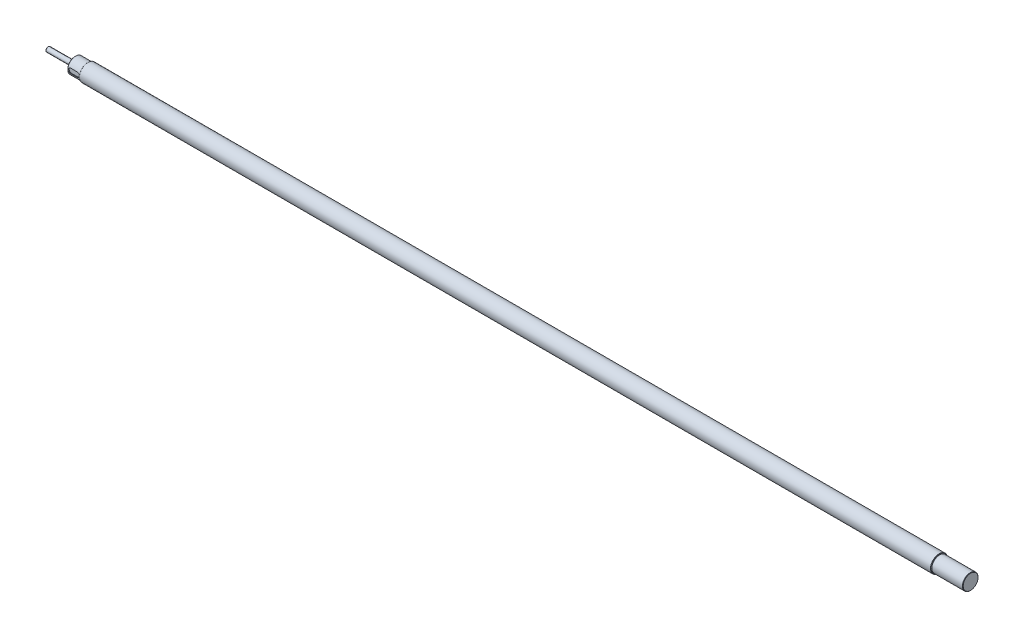
from build123d import *

# Parameters (mm, degrees)
CUT_EXTRUDE_1_DEPTH = 1.2
SKETCH_5_R          = 4
CUT_EXTRUDE_2_DEPTH = 5


with BuildPart() as part:
    # Эскиз1 → Повернуть1 (revolve)
    with BuildSketch(Plane.XY):
        with BuildLine():
            Line((0, 2.5), (0, 0))
            Line((0, 0), (720.314175827, 0))
            Line((720.314175827, 0), (1185, 0))
            Line((1185, 0), (1185, 9.5))
            Line((1185, 9.5), (1184.5, 10))
            Line((1184.5, 10), (1145.2, 10))
            ThreePointArc((1145.2, 10), (1145.058578644, 10.058578644), (1145, 10.2))
            Line((1145, 10.2), (1145, 10.5))
            Line((1145, 10.5), (1144.5, 11))
            Line((1144.5, 11), (51.5, 11))
            Line((51.5, 11), (51, 10.5))
            Line((51, 10.5), (51, 10.2))
            ThreePointArc((51, 10.2), (50.941421356, 10.058578644), (50.8, 10))
            Line((50.8, 10), (35.5, 10))
            Line((35.5, 10), (35, 9.5))
            Line((35, 9.5), (35, 3.5))
            ThreePointArc((35, 3.5), (34.853553391, 3.146446609), (34.5, 3))
            Line((34.5, 3), (0.5, 3))
            Line((0.5, 3), (0, 2.5))
        make_face()
    revolve(axis=Axis((0, 0, 0), (1, 0, 0)))

    # Эскиз3 → Вырез-Вытянуть1 (cut)
    with BuildSketch(Plane.XY.offset(10)):
        with BuildLine():
            Line((39, 3), (47, 3))
            ThreePointArc((47, 3), (50, 0), (47, -3))
            Line((47, -3), (39, -3))
            ThreePointArc((39, -3), (36, 0), (39, 3))
        make_face()
    extrude(amount=-CUT_EXTRUDE_1_DEPTH, mode=Mode.SUBTRACT)

    # Эскиз5 → Вырез-Вытянуть2 (cut)
    with BuildSketch(Plane(origin=(0, 0, -10), x_dir=(-1, 0, 0), z_dir=(0, 0, -1))):
        with Locations((-1155, 0)):
            Circle(SKETCH_5_R)
    extrude(amount=-CUT_EXTRUDE_2_DEPTH, mode=Mode.SUBTRACT)


solid = part.part
